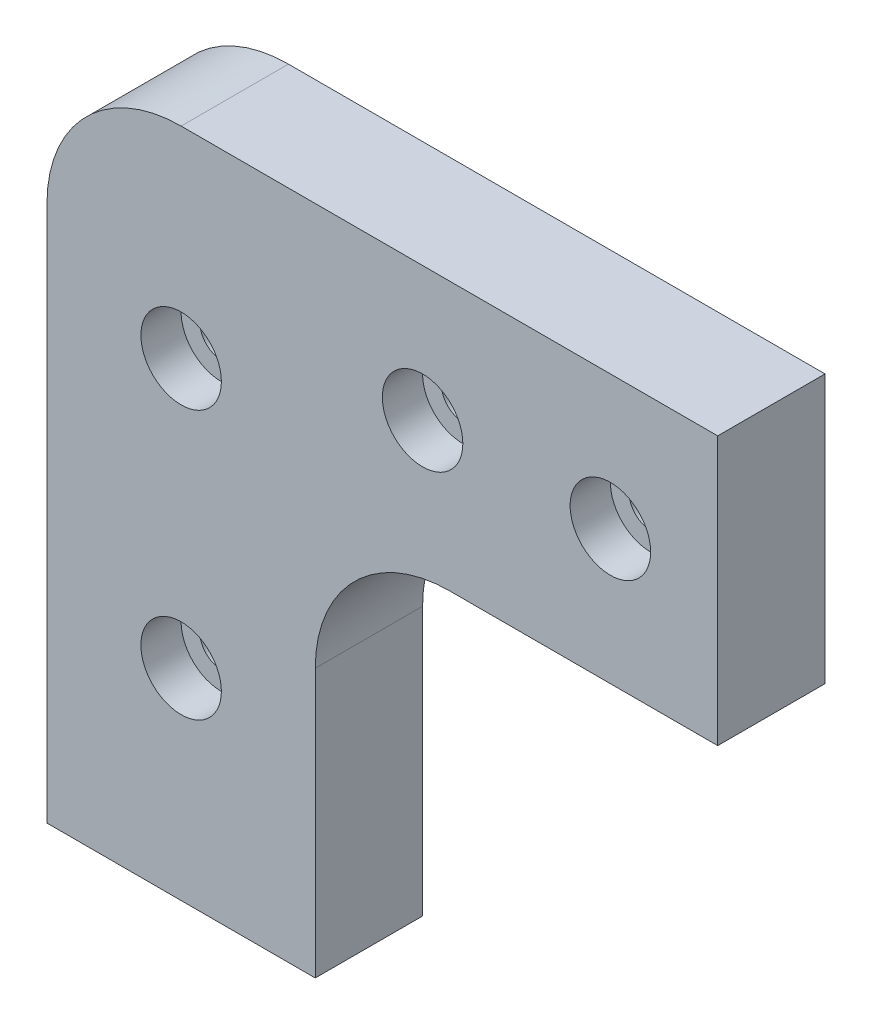
from build123d import *

# Parameters (mm, degrees)
SKETCH_1_R          = 1.6
EXTRUDE_1_DEPTH     = 8
SKETCH_2_R          = 3
CUT_EXTRUDE_1_DEPTH = 3
FILLET_1_R          = 10


with BuildPart() as part:
    # 草图1 → 凸台-拉伸1 (new body)
    with BuildSketch(Plane.XY):
        Polygon((10, 57.5), (10, 27.5), (-10, 27.5), (-10, 77.5), (40, 77.5), (40, 57.5), align=None)
        with Locations((32, 67.5)):
            Circle(SKETCH_1_R, mode=Mode.SUBTRACT)
        with Locations((18, 67.5)):
            Circle(SKETCH_1_R, mode=Mode.SUBTRACT)
        with Locations((0, 62.5)):
            Circle(SKETCH_1_R, mode=Mode.SUBTRACT)
        with Locations((0, 42.5)):
            Circle(SKETCH_1_R, mode=Mode.SUBTRACT)
    extrude(amount=EXTRUDE_1_DEPTH)

    # 草图2 → 切除-拉伸1 (cut)
    with BuildSketch(Plane.XY.offset(8)):
        with Locations((32, 67.5)):
            Circle(SKETCH_2_R)
        with Locations((18, 67.5)):
            Circle(SKETCH_2_R)
        with Locations((0, 62.5)):
            Circle(SKETCH_2_R)
        with Locations((0, 42.5)):
            Circle(SKETCH_2_R)
    extrude(amount=-CUT_EXTRUDE_1_DEPTH, mode=Mode.SUBTRACT)

    # 圆角1
    fillet_1_edges = [part.edges().sort_by_distance(p)[0] for p in [
        (-10, 77.5, 4),
        (10, 57.5, 4),
    ]]
    fillet(fillet_1_edges, radius=FILLET_1_R)


solid = part.part
